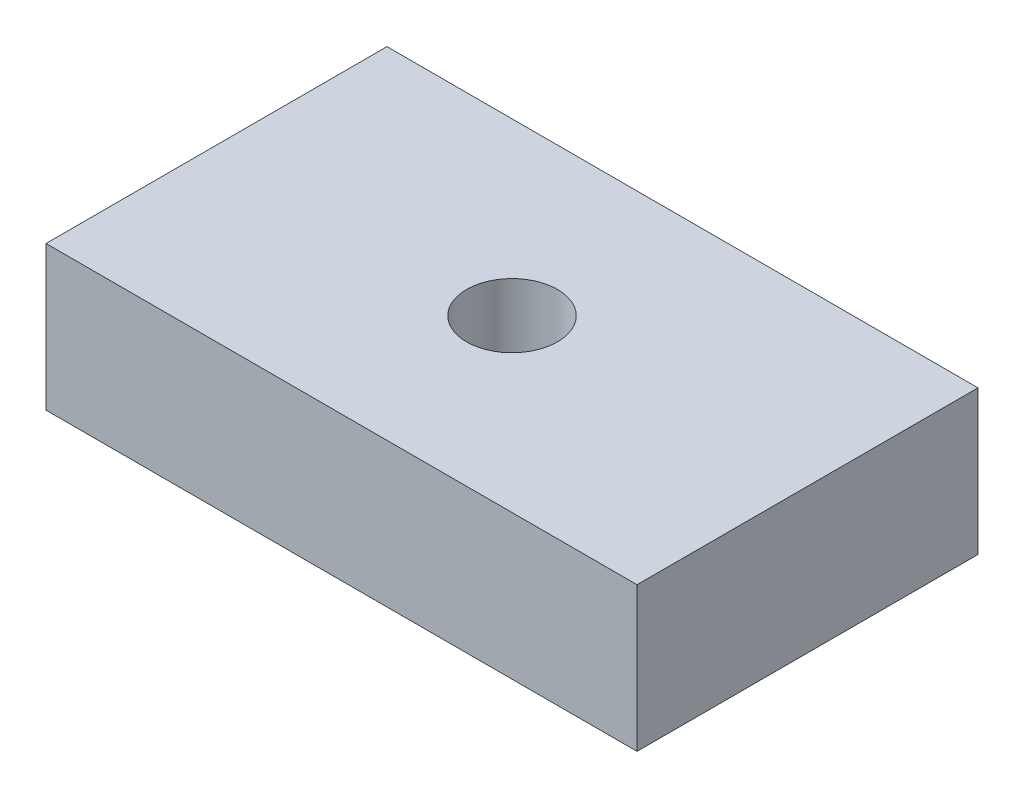
from build123d import *

# Parameters (mm, degrees)
SKETCH1_W           = 52
SKETCH1_H           = 15
BOSS_EXTRUDE1_DEPTH = 6.35
SKETCH3_R           = 2
CUT_EXTRUDE2_DEPTH  = 28.795188433
SKETCH2_W           = 26
SKETCH2_H           = 15
CUT_EXTRUDE1_DEPTH  = 28.795188433


with BuildPart() as part:
    # Sketch1 → Boss-Extrude1 (new body)
    with BuildSketch(Plane(origin=(0, 0, 0), x_dir=(1, 0, 0), z_dir=(0, 1, 0))):
        Rectangle(SKETCH1_W, SKETCH1_H)
    extrude(amount=BOSS_EXTRUDE1_DEPTH)

    # Sketch3 → Cut-Extrude2 (cut, through all)
    with BuildSketch(Plane(origin=(0, 6.35, 0), x_dir=(1, 0, 0), z_dir=(0, 1, 0))):
        with Locations(Location((-13, 0, 0), (0, 0, 270))):
            Circle(SKETCH3_R)
        with Locations(Location((13, 0, 0), (0, 0, 270))):
            Circle(SKETCH3_R)
    extrude(amount=-CUT_EXTRUDE2_DEPTH, mode=Mode.SUBTRACT)

    # Sketch2 → Cut-Extrude1 (cut, through all)
    with BuildSketch(Plane(origin=(0, 6.35, 0), x_dir=(1, 0, 0), z_dir=(0, 1, 0))):
        with Locations((13, 0)):
            Rectangle(SKETCH2_W, SKETCH2_H)
    extrude(amount=-CUT_EXTRUDE1_DEPTH, mode=Mode.SUBTRACT)


solid = part.part
